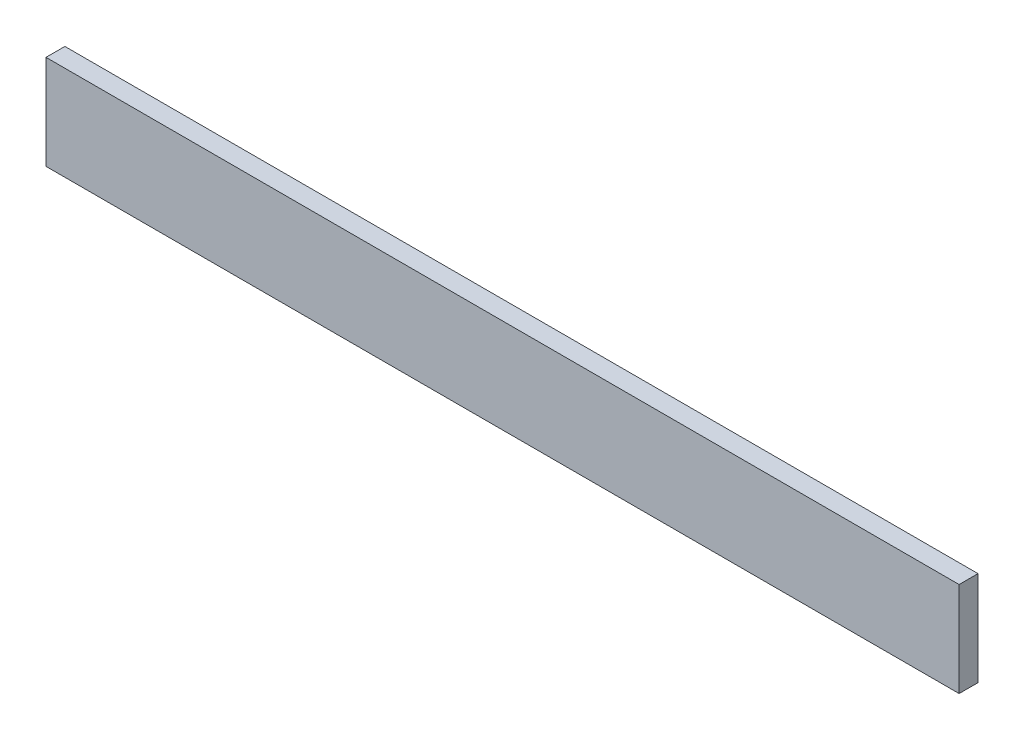
from build123d import *

# Parameters (mm, degrees)
SKETCH_1_W      = 96.674841249
SKETCH_1_H      = 10
EXTRUDE_1_DEPTH = 2


with BuildPart() as part:
    # 草图1 → 凸台-拉伸1 (new body)
    with BuildSketch(Plane(origin=(0, 0, 120.017510674), x_dir=(-1, 0, 0), z_dir=(0, 0, -1))):
        with Locations((8.715738653, 34.035364625)):
            Rectangle(SKETCH_1_W, SKETCH_1_H)
    extrude(amount=EXTRUDE_1_DEPTH)


solid = part.part
